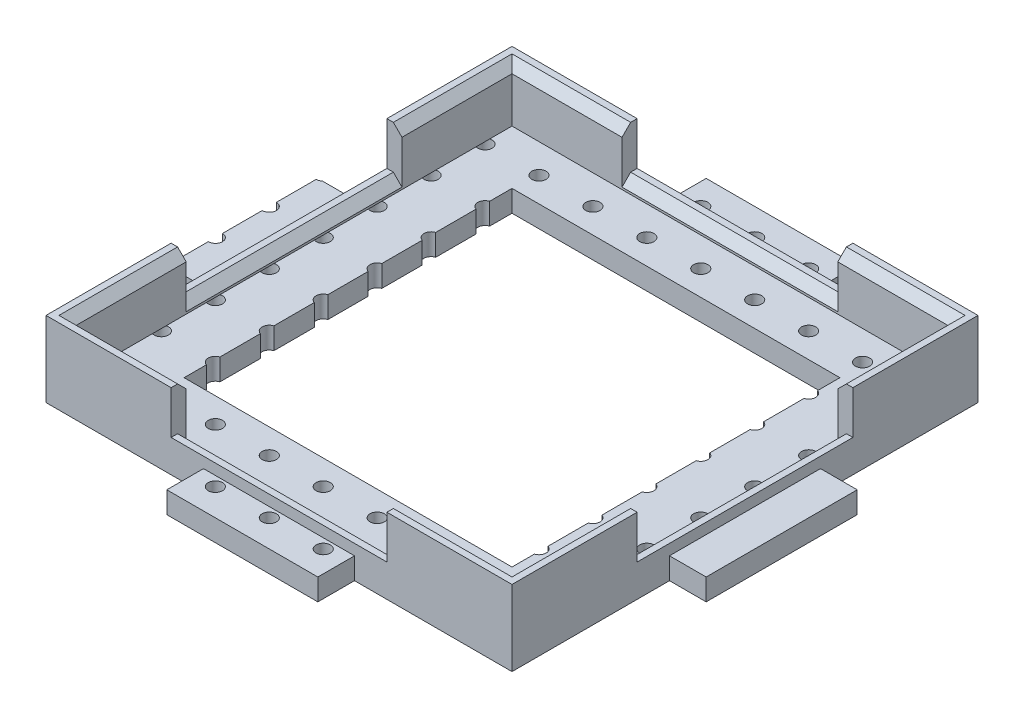
from build123d import *

# Parameters (mm, degrees)
SKETCH1_W                      = 216
SKETCH1_H                      = 216
SKETCH1_W_2                    = 202
SKETCH1_H_2                    = 202
BOSS_EXTRUDE1_DEPTH            = 25
SKETCH3_W                      = 100
SKETCH3_H                      = 20
CUT_EXTRUDE1_DEPTH             = 155.767567662
SKETCH2_W                      = 216
SKETCH2_H                      = 216
SKETCH2_W_2                    = 152
SKETCH2_H_2                    = 152
BOSS_EXTRUDE2_DEPTH            = 10
SKETCH4_W                      = 70
SKETCH4_H                      = 17
BOSS_EXTRUDE3_DEPTH            = 10
SKETCH5_R                      = 3.3
CUT_EXTRUDE2_DEPTH             = 168.074833533
CIRPATTERN1_COUNT              = 4
LPATTERN1_COUNT                = 11
LPATTERN1_PITCH                = 25
LPATTERN2_COUNT                = 5
LPATTERN2_PITCH                = 25
LPATTERN2_COPY_1_SKETCH_R      = 3.3
LPATTERN2_COPY_1_DEPTH         = 168.074833533
LPATTERN2_COPY_2_SKETCH_R      = 3.3
LPATTERN2_COPY_2_DEPTH         = 168.074833533
LPATTERN2_COPY_3_SKETCH_R      = 3.3
LPATTERN2_COPY_3_DEPTH         = 168.074833533
LPATTERN2_COPY_4_SKETCH_R      = 3.3
LPATTERN2_COPY_4_DEPTH         = 168.074833533
LPATTERN2_COPY_5_SKETCH_R      = 3.3
LPATTERN2_COPY_5_DEPTH         = 168.074833533
LPATTERN2_COPY_6_SKETCH_R      = 3.3
LPATTERN2_COPY_6_DEPTH         = 168.074833533
LPATTERN2_COPY_7_SKETCH_R      = 3.3
LPATTERN2_COPY_7_DEPTH         = 168.074833533
LPATTERN2_COPY_8_SKETCH_R      = 3.3
LPATTERN2_COPY_8_DEPTH         = 168.074833533
LPATTERN2_COPY_9_SKETCH_R      = 3.3
LPATTERN2_COPY_9_DEPTH         = 168.074833533
LPATTERN2_COPY_10_SKETCH_R     = 3.3
LPATTERN2_COPY_10_DEPTH        = 168.074833533
LPATTERN2_COPY_11_SKETCH_R     = 3.3
LPATTERN2_COPY_11_DEPTH        = 168.074833533
LPATTERN2_COPY_12_SKETCH_R     = 3.3
LPATTERN2_COPY_12_DEPTH        = 168.074833533
LPATTERN2_COPY_13_SKETCH_R     = 3.3
LPATTERN2_COPY_13_DEPTH        = 168.074833533
LPATTERN2_COPY_14_SKETCH_R     = 3.3
LPATTERN2_COPY_14_DEPTH        = 168.074833533
LPATTERN2_COPY_15_SKETCH_R     = 3.3
LPATTERN2_COPY_15_DEPTH        = 168.074833533
LPATTERN2_COPY_16_SKETCH_R     = 3.3
LPATTERN2_COPY_16_DEPTH        = 168.074833533
LPATTERN2_COPY_17_SKETCH_R     = 3.3
LPATTERN2_COPY_17_DEPTH        = 168.074833533
LPATTERN2_COPY_18_SKETCH_R     = 3.3
LPATTERN2_COPY_18_DEPTH        = 168.074833533
LPATTERN2_COPY_19_SKETCH_R     = 3.3
LPATTERN2_COPY_19_DEPTH        = 168.074833533
LPATTERN2_COPY_20_SKETCH_R     = 3.3
LPATTERN2_COPY_20_DEPTH        = 168.074833533
LPATTERN2_COPY_21_SKETCH_R     = 3.3
LPATTERN2_COPY_21_DEPTH        = 168.074833533
LPATTERN2_COPY_22_SKETCH_R     = 3.3
LPATTERN2_COPY_22_DEPTH        = 168.074833533
LPATTERN2_COPY_23_SKETCH_R     = 3.3
LPATTERN2_COPY_23_DEPTH        = 168.074833533
LPATTERN2_COPY_24_SKETCH_R     = 3.3
LPATTERN2_COPY_24_DEPTH        = 168.074833533
LPATTERN2_COPY_25_SKETCH_R     = 3.3
LPATTERN2_COPY_25_DEPTH        = 168.074833533
LPATTERN2_COPY_26_SKETCH_R     = 3.3
LPATTERN2_COPY_26_DEPTH        = 168.074833533
LPATTERN2_COPY_27_SKETCH_R     = 3.3
LPATTERN2_COPY_27_DEPTH        = 168.074833533
LPATTERN2_COPY_28_SKETCH_R     = 3.3
LPATTERN2_COPY_28_DEPTH        = 168.074833533
LPATTERN2_COPY_29_SKETCH_R     = 3.3
LPATTERN2_COPY_29_DEPTH        = 168.074833533
LPATTERN2_COPY_30_SKETCH_R     = 3.3
LPATTERN2_COPY_30_DEPTH        = 168.074833533
LPATTERN2_COPY_31_SKETCH_R     = 3.3
LPATTERN2_COPY_31_DEPTH        = 168.074833533
LPATTERN2_COPY_32_SKETCH_R     = 3.3
LPATTERN2_COPY_32_DEPTH        = 168.074833533
LPATTERN2_COPY_33_SKETCH_R     = 3.3
LPATTERN2_COPY_33_DEPTH        = 168.074833533
LPATTERN2_COPY_34_SKETCH_R     = 3.3
LPATTERN2_COPY_34_DEPTH        = 168.074833533
LPATTERN2_COPY_35_SKETCH_R     = 3.3
LPATTERN2_COPY_35_DEPTH        = 168.074833533
LPATTERN2_COPY_36_SKETCH_R     = 3.3
LPATTERN2_COPY_36_DEPTH        = 168.074833533
LPATTERN2_COPY_37_SKETCH_R     = 3.3
LPATTERN2_COPY_37_DEPTH        = 168.074833533
LPATTERN2_COPY_38_SKETCH_R     = 3.3
LPATTERN2_COPY_38_DEPTH        = 168.074833533
LPATTERN2_COPY_39_SKETCH_R     = 3.3
LPATTERN2_COPY_39_DEPTH        = 168.074833533
LPATTERN2_COPY_40_SKETCH_R     = 3.3
LPATTERN2_COPY_40_DEPTH        = 168.074833533
LPATTERN2_COL_COUNT            = 6
LPATTERN2_COL_PITCH            = 25
LPATTERN2_COL_COPY_1_SKETCH_R  = 3.3
LPATTERN2_COL_COPY_1_DEPTH     = 168.074833533
LPATTERN2_COL_COPY_2_SKETCH_R  = 3.3
LPATTERN2_COL_COPY_2_DEPTH     = 168.074833533
LPATTERN2_COL_COPY_3_SKETCH_R  = 3.3
LPATTERN2_COL_COPY_3_DEPTH     = 168.074833533
LPATTERN2_COL_COPY_4_SKETCH_R  = 3.3
LPATTERN2_COL_COPY_4_DEPTH     = 168.074833533
LPATTERN2_COL_COPY_5_SKETCH_R  = 3.3
LPATTERN2_COL_COPY_5_DEPTH     = 168.074833533
LPATTERN2_COL_COPY_6_SKETCH_R  = 3.3
LPATTERN2_COL_COPY_6_DEPTH     = 168.074833533
LPATTERN2_COL_COPY_7_SKETCH_R  = 3.3
LPATTERN2_COL_COPY_7_DEPTH     = 168.074833533
LPATTERN2_COL_COPY_8_SKETCH_R  = 3.3
LPATTERN2_COL_COPY_8_DEPTH     = 168.074833533
LPATTERN2_COL_COPY_9_SKETCH_R  = 3.3
LPATTERN2_COL_COPY_9_DEPTH     = 168.074833533
LPATTERN2_COL_COPY_10_SKETCH_R = 3.3
LPATTERN2_COL_COPY_10_DEPTH    = 168.074833533
LPATTERN2_COL_COPY_11_SKETCH_R = 3.3
LPATTERN2_COL_COPY_11_DEPTH    = 168.074833533
LPATTERN2_COL_COPY_12_SKETCH_R = 3.3
LPATTERN2_COL_COPY_12_DEPTH    = 168.074833533
LPATTERN2_COL_COPY_13_SKETCH_R = 3.3
LPATTERN2_COL_COPY_13_DEPTH    = 168.074833533
LPATTERN2_COL_COPY_14_SKETCH_R = 3.3
LPATTERN2_COL_COPY_14_DEPTH    = 168.074833533
LPATTERN2_COL_COPY_15_SKETCH_R = 3.3
LPATTERN2_COL_COPY_15_DEPTH    = 168.074833533
LPATTERN2_COL_COPY_16_SKETCH_R = 3.3
LPATTERN2_COL_COPY_16_DEPTH    = 168.074833533
LPATTERN2_COL_COPY_17_SKETCH_R = 3.3
LPATTERN2_COL_COPY_17_DEPTH    = 168.074833533
LPATTERN2_COL_COPY_18_SKETCH_R = 3.3
LPATTERN2_COL_COPY_18_DEPTH    = 168.074833533
LPATTERN2_COL_COPY_19_SKETCH_R = 3.3
LPATTERN2_COL_COPY_19_DEPTH    = 168.074833533
LPATTERN2_COL_COPY_20_SKETCH_R = 3.3
LPATTERN2_COL_COPY_20_DEPTH    = 168.074833533
LPATTERN2_COL_COPY_21_SKETCH_R = 3.3
LPATTERN2_COL_COPY_21_DEPTH    = 168.074833533
LPATTERN2_COL_COPY_22_SKETCH_R = 3.3
LPATTERN2_COL_COPY_22_DEPTH    = 168.074833533
LPATTERN2_COL_COPY_23_SKETCH_R = 3.3
LPATTERN2_COL_COPY_23_DEPTH    = 168.074833533
LPATTERN2_COL_COPY_24_SKETCH_R = 3.3
LPATTERN2_COL_COPY_24_DEPTH    = 168.074833533
LPATTERN2_COL_COPY_25_SKETCH_R = 3.3
LPATTERN2_COL_COPY_25_DEPTH    = 168.074833533
LPATTERN2_COL_COPY_26_SKETCH_R = 3.3
LPATTERN2_COL_COPY_26_DEPTH    = 168.074833533
LPATTERN2_COL_COPY_27_SKETCH_R = 3.3
LPATTERN2_COL_COPY_27_DEPTH    = 168.074833533
LPATTERN2_COL_COPY_28_SKETCH_R = 3.3
LPATTERN2_COL_COPY_28_DEPTH    = 168.074833533
LPATTERN2_COL_COPY_29_SKETCH_R = 3.3
LPATTERN2_COL_COPY_29_DEPTH    = 168.074833533
LPATTERN2_COL_COPY_30_SKETCH_R = 3.3
LPATTERN2_COL_COPY_30_DEPTH    = 168.074833533
LPATTERN2_COL_COPY_31_SKETCH_R = 3.3
LPATTERN2_COL_COPY_31_DEPTH    = 168.074833533
LPATTERN2_COL_COPY_32_SKETCH_R = 3.3
LPATTERN2_COL_COPY_32_DEPTH    = 168.074833533
LPATTERN2_COL_COPY_33_SKETCH_R = 3.3
LPATTERN2_COL_COPY_33_DEPTH    = 168.074833533
LPATTERN2_COL_COPY_34_SKETCH_R = 3.3
LPATTERN2_COL_COPY_34_DEPTH    = 168.074833533
LPATTERN2_COL_COPY_35_SKETCH_R = 3.3
LPATTERN2_COL_COPY_35_DEPTH    = 168.074833533
LPATTERN2_COL_COPY_36_SKETCH_R = 3.3
LPATTERN2_COL_COPY_36_DEPTH    = 168.074833533
LPATTERN2_COL_COPY_37_SKETCH_R = 3.3
LPATTERN2_COL_COPY_37_DEPTH    = 168.074833533
LPATTERN2_COL_COPY_38_SKETCH_R = 3.3
LPATTERN2_COL_COPY_38_DEPTH    = 168.074833533
LPATTERN2_COL_COPY_39_SKETCH_R = 3.3
LPATTERN2_COL_COPY_39_DEPTH    = 168.074833533
LPATTERN2_COL_COPY_40_SKETCH_R = 3.3
LPATTERN2_COL_COPY_40_DEPTH    = 168.074833533
LPATTERN2_COL_COPY_41_SKETCH_R = 3.3
LPATTERN2_COL_COPY_41_DEPTH    = 168.074833533
LPATTERN2_COL_COPY_42_SKETCH_R = 3.3
LPATTERN2_COL_COPY_42_DEPTH    = 168.074833533
LPATTERN2_COL_COPY_43_SKETCH_R = 3.3
LPATTERN2_COL_COPY_43_DEPTH    = 168.074833533
LPATTERN2_COL_COPY_44_SKETCH_R = 3.3
LPATTERN2_COL_COPY_44_DEPTH    = 168.074833533
LPATTERN2_COL_COPY_45_SKETCH_R = 3.3
LPATTERN2_COL_COPY_45_DEPTH    = 168.074833533
LPATTERN2_COL_COPY_46_SKETCH_R = 3.3
LPATTERN2_COL_COPY_46_DEPTH    = 168.074833533
LPATTERN2_COL_COPY_47_SKETCH_R = 3.3
LPATTERN2_COL_COPY_47_DEPTH    = 168.074833533
LPATTERN2_COL_COPY_48_SKETCH_R = 3.3
LPATTERN2_COL_COPY_48_DEPTH    = 168.074833533
LPATTERN2_COL_COPY_49_SKETCH_R = 3.3
LPATTERN2_COL_COPY_49_DEPTH    = 168.074833533
LPATTERN2_COL_COPY_50_SKETCH_R = 3.3
LPATTERN2_COL_COPY_50_DEPTH    = 168.074833533
CHAMFER1_SIZE                  = 4


with BuildPart() as part:
    # Sketch1 → Boss-Extrude1 (new body)
    with BuildSketch(Plane(origin=(0, 0, 0), x_dir=(1, 0, 0), z_dir=(0, 1, 0))):
        Rectangle(SKETCH1_W, SKETCH1_H)
        Rectangle(SKETCH1_W_2, SKETCH1_H_2, mode=Mode.SUBTRACT)
    extrude(amount=BOSS_EXTRUDE1_DEPTH)

    # Sketch3 → Cut-Extrude1 (cut, through all)
    with BuildSketch(Plane.XY):
        with Locations((0, 15)):
            Rectangle(SKETCH3_W, SKETCH3_H)
    cut_extrude1 = extrude(amount=CUT_EXTRUDE1_DEPTH, mode=Mode.SUBTRACT)

    # Sketch2 → Boss-Extrude2 (add)
    with BuildSketch(Plane(origin=(0, 0, 0), x_dir=(1, 0, 0), z_dir=(0, 1, 0))):
        Rectangle(SKETCH2_W, SKETCH2_H)
        Rectangle(SKETCH2_W_2, SKETCH2_H_2, mode=Mode.SUBTRACT)
    extrude(amount=-BOSS_EXTRUDE2_DEPTH)

    # Sketch4 → Boss-Extrude3 (add)
    with BuildSketch(Plane(origin=(0, 0, 0), x_dir=(1, 0, 0), z_dir=(0, 1, 0))):
        with Locations((0, -116.5)):
            Rectangle(SKETCH4_W, SKETCH4_H)
    boss_extrude3 = extrude(amount=-BOSS_EXTRUDE3_DEPTH)

    # Sketch5 → Cut-Extrude2 (cut, through all)
    with BuildSketch(Plane(origin=(0, 0, 0), x_dir=(1, 0, 0), z_dir=(0, 1, 0))):
        with Locations(Location((-25, -112.5, 0), (0, 0, 270))):
            Circle(SKETCH5_R)
    cut_extrude2 = extrude(amount=-CUT_EXTRUDE2_DEPTH, mode=Mode.SUBTRACT)

    # CirPattern1: Cut-Extrude1, Boss-Extrude3 ×4 about axis
    cirpattern1_axis = Axis((0, 0, 0), (0, 1, 0))
    add([cut_extrude1.rotate(cirpattern1_axis, i * 360 / CIRPATTERN1_COUNT) for i in range(1, CIRPATTERN1_COUNT)], mode=Mode.SUBTRACT)
    add([boss_extrude3.rotate(cirpattern1_axis, i * 360 / CIRPATTERN1_COUNT) for i in range(1, CIRPATTERN1_COUNT)])

    # LPattern1: Cut-Extrude2 ×11
    with Locations(*[(0, 0, -i * LPATTERN1_PITCH) for i in range(1, LPATTERN1_COUNT)]):
        add(cut_extrude2, mode=Mode.SUBTRACT)

    # LPattern2: Cut-Extrude2 ×5
    with Locations(*[(-i * LPATTERN2_PITCH, 0, 0) for i in range(1, LPATTERN2_COUNT)]):
        add(cut_extrude2, mode=Mode.SUBTRACT)

    # LPattern2 copy 1 sketch → LPattern2 copy 1 (cut, through all)
    with BuildSketch(Plane(origin=(-25, 0, -25), x_dir=(1, 0, 0), z_dir=(0, 1, 0))):
        with Locations(Location((-25, -112.5, 0), (0, 0, 270))):
            Circle(LPATTERN2_COPY_1_SKETCH_R)
    extrude(amount=-LPATTERN2_COPY_1_DEPTH, mode=Mode.SUBTRACT)

    # LPattern2 copy 2 sketch → LPattern2 copy 2 (cut, through all)
    with BuildSketch(Plane(origin=(-50, 0, -25), x_dir=(1, 0, 0), z_dir=(0, 1, 0))):
        with Locations(Location((-25, -112.5, 0), (0, 0, 270))):
            Circle(LPATTERN2_COPY_2_SKETCH_R)
    extrude(amount=-LPATTERN2_COPY_2_DEPTH, mode=Mode.SUBTRACT)

    # LPattern2 copy 3 sketch → LPattern2 copy 3 (cut, through all)
    with BuildSketch(Plane(origin=(-75, 0, -25), x_dir=(1, 0, 0), z_dir=(0, 1, 0))):
        with Locations(Location((-25, -112.5, 0), (0, 0, 270))):
            Circle(LPATTERN2_COPY_3_SKETCH_R)
    extrude(amount=-LPATTERN2_COPY_3_DEPTH, mode=Mode.SUBTRACT)

    # LPattern2 copy 4 sketch → LPattern2 copy 4 (cut, through all)
    with BuildSketch(Plane(origin=(-100, 0, -25), x_dir=(1, 0, 0), z_dir=(0, 1, 0))):
        with Locations(Location((-25, -112.5, 0), (0, 0, 270))):
            Circle(LPATTERN2_COPY_4_SKETCH_R)
    extrude(amount=-LPATTERN2_COPY_4_DEPTH, mode=Mode.SUBTRACT)

    # LPattern2 copy 5 sketch → LPattern2 copy 5 (cut, through all)
    with BuildSketch(Plane(origin=(-25, 0, -50), x_dir=(1, 0, 0), z_dir=(0, 1, 0))):
        with Locations(Location((-25, -112.5, 0), (0, 0, 270))):
            Circle(LPATTERN2_COPY_5_SKETCH_R)
    extrude(amount=-LPATTERN2_COPY_5_DEPTH, mode=Mode.SUBTRACT)

    # LPattern2 copy 6 sketch → LPattern2 copy 6 (cut, through all)
    with BuildSketch(Plane(origin=(-50, 0, -50), x_dir=(1, 0, 0), z_dir=(0, 1, 0))):
        with Locations(Location((-25, -112.5, 0), (0, 0, 270))):
            Circle(LPATTERN2_COPY_6_SKETCH_R)
    extrude(amount=-LPATTERN2_COPY_6_DEPTH, mode=Mode.SUBTRACT)

    # LPattern2 copy 7 sketch → LPattern2 copy 7 (cut, through all)
    with BuildSketch(Plane(origin=(-75, 0, -50), x_dir=(1, 0, 0), z_dir=(0, 1, 0))):
        with Locations(Location((-25, -112.5, 0), (0, 0, 270))):
            Circle(LPATTERN2_COPY_7_SKETCH_R)
    extrude(amount=-LPATTERN2_COPY_7_DEPTH, mode=Mode.SUBTRACT)

    # LPattern2 copy 8 sketch → LPattern2 copy 8 (cut, through all)
    with BuildSketch(Plane(origin=(-100, 0, -50), x_dir=(1, 0, 0), z_dir=(0, 1, 0))):
        with Locations(Location((-25, -112.5, 0), (0, 0, 270))):
            Circle(LPATTERN2_COPY_8_SKETCH_R)
    extrude(amount=-LPATTERN2_COPY_8_DEPTH, mode=Mode.SUBTRACT)

    # LPattern2 copy 9 sketch → LPattern2 copy 9 (cut, through all)
    with BuildSketch(Plane(origin=(-25, 0, -75), x_dir=(1, 0, 0), z_dir=(0, 1, 0))):
        with Locations(Location((-25, -112.5, 0), (0, 0, 270))):
            Circle(LPATTERN2_COPY_9_SKETCH_R)
    extrude(amount=-LPATTERN2_COPY_9_DEPTH, mode=Mode.SUBTRACT)

    # LPattern2 copy 10 sketch → LPattern2 copy 10 (cut, through all)
    with BuildSketch(Plane(origin=(-50, 0, -75), x_dir=(1, 0, 0), z_dir=(0, 1, 0))):
        with Locations(Location((-25, -112.5, 0), (0, 0, 270))):
            Circle(LPATTERN2_COPY_10_SKETCH_R)
    extrude(amount=-LPATTERN2_COPY_10_DEPTH, mode=Mode.SUBTRACT)

    # LPattern2 copy 11 sketch → LPattern2 copy 11 (cut, through all)
    with BuildSketch(Plane(origin=(-75, 0, -75), x_dir=(1, 0, 0), z_dir=(0, 1, 0))):
        with Locations(Location((-25, -112.5, 0), (0, 0, 270))):
            Circle(LPATTERN2_COPY_11_SKETCH_R)
    extrude(amount=-LPATTERN2_COPY_11_DEPTH, mode=Mode.SUBTRACT)

    # LPattern2 copy 12 sketch → LPattern2 copy 12 (cut, through all)
    with BuildSketch(Plane(origin=(-100, 0, -75), x_dir=(1, 0, 0), z_dir=(0, 1, 0))):
        with Locations(Location((-25, -112.5, 0), (0, 0, 270))):
            Circle(LPATTERN2_COPY_12_SKETCH_R)
    extrude(amount=-LPATTERN2_COPY_12_DEPTH, mode=Mode.SUBTRACT)

    # LPattern2 copy 13 sketch → LPattern2 copy 13 (cut, through all)
    with BuildSketch(Plane(origin=(-25, 0, -100), x_dir=(1, 0, 0), z_dir=(0, 1, 0))):
        with Locations(Location((-25, -112.5, 0), (0, 0, 270))):
            Circle(LPATTERN2_COPY_13_SKETCH_R)
    extrude(amount=-LPATTERN2_COPY_13_DEPTH, mode=Mode.SUBTRACT)

    # LPattern2 copy 14 sketch → LPattern2 copy 14 (cut, through all)
    with BuildSketch(Plane(origin=(-50, 0, -100), x_dir=(1, 0, 0), z_dir=(0, 1, 0))):
        with Locations(Location((-25, -112.5, 0), (0, 0, 270))):
            Circle(LPATTERN2_COPY_14_SKETCH_R)
    extrude(amount=-LPATTERN2_COPY_14_DEPTH, mode=Mode.SUBTRACT)

    # LPattern2 copy 15 sketch → LPattern2 copy 15 (cut, through all)
    with BuildSketch(Plane(origin=(-75, 0, -100), x_dir=(1, 0, 0), z_dir=(0, 1, 0))):
        with Locations(Location((-25, -112.5, 0), (0, 0, 270))):
            Circle(LPATTERN2_COPY_15_SKETCH_R)
    extrude(amount=-LPATTERN2_COPY_15_DEPTH, mode=Mode.SUBTRACT)

    # LPattern2 copy 16 sketch → LPattern2 copy 16 (cut, through all)
    with BuildSketch(Plane(origin=(-100, 0, -100), x_dir=(1, 0, 0), z_dir=(0, 1, 0))):
        with Locations(Location((-25, -112.5, 0), (0, 0, 270))):
            Circle(LPATTERN2_COPY_16_SKETCH_R)
    extrude(amount=-LPATTERN2_COPY_16_DEPTH, mode=Mode.SUBTRACT)

    # LPattern2 copy 17 sketch → LPattern2 copy 17 (cut, through all)
    with BuildSketch(Plane(origin=(-25, 0, -125), x_dir=(1, 0, 0), z_dir=(0, 1, 0))):
        with Locations(Location((-25, -112.5, 0), (0, 0, 270))):
            Circle(LPATTERN2_COPY_17_SKETCH_R)
    extrude(amount=-LPATTERN2_COPY_17_DEPTH, mode=Mode.SUBTRACT)

    # LPattern2 copy 18 sketch → LPattern2 copy 18 (cut, through all)
    with BuildSketch(Plane(origin=(-50, 0, -125), x_dir=(1, 0, 0), z_dir=(0, 1, 0))):
        with Locations(Location((-25, -112.5, 0), (0, 0, 270))):
            Circle(LPATTERN2_COPY_18_SKETCH_R)
    extrude(amount=-LPATTERN2_COPY_18_DEPTH, mode=Mode.SUBTRACT)

    # LPattern2 copy 19 sketch → LPattern2 copy 19 (cut, through all)
    with BuildSketch(Plane(origin=(-75, 0, -125), x_dir=(1, 0, 0), z_dir=(0, 1, 0))):
        with Locations(Location((-25, -112.5, 0), (0, 0, 270))):
            Circle(LPATTERN2_COPY_19_SKETCH_R)
    extrude(amount=-LPATTERN2_COPY_19_DEPTH, mode=Mode.SUBTRACT)

    # LPattern2 copy 20 sketch → LPattern2 copy 20 (cut, through all)
    with BuildSketch(Plane(origin=(-100, 0, -125), x_dir=(1, 0, 0), z_dir=(0, 1, 0))):
        with Locations(Location((-25, -112.5, 0), (0, 0, 270))):
            Circle(LPATTERN2_COPY_20_SKETCH_R)
    extrude(amount=-LPATTERN2_COPY_20_DEPTH, mode=Mode.SUBTRACT)

    # LPattern2 copy 21 sketch → LPattern2 copy 21 (cut, through all)
    with BuildSketch(Plane(origin=(-25, 0, -150), x_dir=(1, 0, 0), z_dir=(0, 1, 0))):
        with Locations(Location((-25, -112.5, 0), (0, 0, 270))):
            Circle(LPATTERN2_COPY_21_SKETCH_R)
    extrude(amount=-LPATTERN2_COPY_21_DEPTH, mode=Mode.SUBTRACT)

    # LPattern2 copy 22 sketch → LPattern2 copy 22 (cut, through all)
    with BuildSketch(Plane(origin=(-50, 0, -150), x_dir=(1, 0, 0), z_dir=(0, 1, 0))):
        with Locations(Location((-25, -112.5, 0), (0, 0, 270))):
            Circle(LPATTERN2_COPY_22_SKETCH_R)
    extrude(amount=-LPATTERN2_COPY_22_DEPTH, mode=Mode.SUBTRACT)

    # LPattern2 copy 23 sketch → LPattern2 copy 23 (cut, through all)
    with BuildSketch(Plane(origin=(-75, 0, -150), x_dir=(1, 0, 0), z_dir=(0, 1, 0))):
        with Locations(Location((-25, -112.5, 0), (0, 0, 270))):
            Circle(LPATTERN2_COPY_23_SKETCH_R)
    extrude(amount=-LPATTERN2_COPY_23_DEPTH, mode=Mode.SUBTRACT)

    # LPattern2 copy 24 sketch → LPattern2 copy 24 (cut, through all)
    with BuildSketch(Plane(origin=(-100, 0, -150), x_dir=(1, 0, 0), z_dir=(0, 1, 0))):
        with Locations(Location((-25, -112.5, 0), (0, 0, 270))):
            Circle(LPATTERN2_COPY_24_SKETCH_R)
    extrude(amount=-LPATTERN2_COPY_24_DEPTH, mode=Mode.SUBTRACT)

    # LPattern2 copy 25 sketch → LPattern2 copy 25 (cut, through all)
    with BuildSketch(Plane(origin=(-25, 0, -175), x_dir=(1, 0, 0), z_dir=(0, 1, 0))):
        with Locations(Location((-25, -112.5, 0), (0, 0, 270))):
            Circle(LPATTERN2_COPY_25_SKETCH_R)
    extrude(amount=-LPATTERN2_COPY_25_DEPTH, mode=Mode.SUBTRACT)

    # LPattern2 copy 26 sketch → LPattern2 copy 26 (cut, through all)
    with BuildSketch(Plane(origin=(-50, 0, -175), x_dir=(1, 0, 0), z_dir=(0, 1, 0))):
        with Locations(Location((-25, -112.5, 0), (0, 0, 270))):
            Circle(LPATTERN2_COPY_26_SKETCH_R)
    extrude(amount=-LPATTERN2_COPY_26_DEPTH, mode=Mode.SUBTRACT)

    # LPattern2 copy 27 sketch → LPattern2 copy 27 (cut, through all)
    with BuildSketch(Plane(origin=(-75, 0, -175), x_dir=(1, 0, 0), z_dir=(0, 1, 0))):
        with Locations(Location((-25, -112.5, 0), (0, 0, 270))):
            Circle(LPATTERN2_COPY_27_SKETCH_R)
    extrude(amount=-LPATTERN2_COPY_27_DEPTH, mode=Mode.SUBTRACT)

    # LPattern2 copy 28 sketch → LPattern2 copy 28 (cut, through all)
    with BuildSketch(Plane(origin=(-100, 0, -175), x_dir=(1, 0, 0), z_dir=(0, 1, 0))):
        with Locations(Location((-25, -112.5, 0), (0, 0, 270))):
            Circle(LPATTERN2_COPY_28_SKETCH_R)
    extrude(amount=-LPATTERN2_COPY_28_DEPTH, mode=Mode.SUBTRACT)

    # LPattern2 copy 29 sketch → LPattern2 copy 29 (cut, through all)
    with BuildSketch(Plane(origin=(-25, 0, -200), x_dir=(1, 0, 0), z_dir=(0, 1, 0))):
        with Locations(Location((-25, -112.5, 0), (0, 0, 270))):
            Circle(LPATTERN2_COPY_29_SKETCH_R)
    extrude(amount=-LPATTERN2_COPY_29_DEPTH, mode=Mode.SUBTRACT)

    # LPattern2 copy 30 sketch → LPattern2 copy 30 (cut, through all)
    with BuildSketch(Plane(origin=(-50, 0, -200), x_dir=(1, 0, 0), z_dir=(0, 1, 0))):
        with Locations(Location((-25, -112.5, 0), (0, 0, 270))):
            Circle(LPATTERN2_COPY_30_SKETCH_R)
    extrude(amount=-LPATTERN2_COPY_30_DEPTH, mode=Mode.SUBTRACT)

    # LPattern2 copy 31 sketch → LPattern2 copy 31 (cut, through all)
    with BuildSketch(Plane(origin=(-75, 0, -200), x_dir=(1, 0, 0), z_dir=(0, 1, 0))):
        with Locations(Location((-25, -112.5, 0), (0, 0, 270))):
            Circle(LPATTERN2_COPY_31_SKETCH_R)
    extrude(amount=-LPATTERN2_COPY_31_DEPTH, mode=Mode.SUBTRACT)

    # LPattern2 copy 32 sketch → LPattern2 copy 32 (cut, through all)
    with BuildSketch(Plane(origin=(-100, 0, -200), x_dir=(1, 0, 0), z_dir=(0, 1, 0))):
        with Locations(Location((-25, -112.5, 0), (0, 0, 270))):
            Circle(LPATTERN2_COPY_32_SKETCH_R)
    extrude(amount=-LPATTERN2_COPY_32_DEPTH, mode=Mode.SUBTRACT)

    # LPattern2 copy 33 sketch → LPattern2 copy 33 (cut, through all)
    with BuildSketch(Plane(origin=(-25, 0, -225), x_dir=(1, 0, 0), z_dir=(0, 1, 0))):
        with Locations(Location((-25, -112.5, 0), (0, 0, 270))):
            Circle(LPATTERN2_COPY_33_SKETCH_R)
    extrude(amount=-LPATTERN2_COPY_33_DEPTH, mode=Mode.SUBTRACT)

    # LPattern2 copy 34 sketch → LPattern2 copy 34 (cut, through all)
    with BuildSketch(Plane(origin=(-50, 0, -225), x_dir=(1, 0, 0), z_dir=(0, 1, 0))):
        with Locations(Location((-25, -112.5, 0), (0, 0, 270))):
            Circle(LPATTERN2_COPY_34_SKETCH_R)
    extrude(amount=-LPATTERN2_COPY_34_DEPTH, mode=Mode.SUBTRACT)

    # LPattern2 copy 35 sketch → LPattern2 copy 35 (cut, through all)
    with BuildSketch(Plane(origin=(-75, 0, -225), x_dir=(1, 0, 0), z_dir=(0, 1, 0))):
        with Locations(Location((-25, -112.5, 0), (0, 0, 270))):
            Circle(LPATTERN2_COPY_35_SKETCH_R)
    extrude(amount=-LPATTERN2_COPY_35_DEPTH, mode=Mode.SUBTRACT)

    # LPattern2 copy 36 sketch → LPattern2 copy 36 (cut, through all)
    with BuildSketch(Plane(origin=(-100, 0, -225), x_dir=(1, 0, 0), z_dir=(0, 1, 0))):
        with Locations(Location((-25, -112.5, 0), (0, 0, 270))):
            Circle(LPATTERN2_COPY_36_SKETCH_R)
    extrude(amount=-LPATTERN2_COPY_36_DEPTH, mode=Mode.SUBTRACT)

    # LPattern2 copy 37 sketch → LPattern2 copy 37 (cut, through all)
    with BuildSketch(Plane(origin=(-25, 0, -250), x_dir=(1, 0, 0), z_dir=(0, 1, 0))):
        with Locations(Location((-25, -112.5, 0), (0, 0, 270))):
            Circle(LPATTERN2_COPY_37_SKETCH_R)
    extrude(amount=-LPATTERN2_COPY_37_DEPTH, mode=Mode.SUBTRACT)

    # LPattern2 copy 38 sketch → LPattern2 copy 38 (cut, through all)
    with BuildSketch(Plane(origin=(-50, 0, -250), x_dir=(1, 0, 0), z_dir=(0, 1, 0))):
        with Locations(Location((-25, -112.5, 0), (0, 0, 270))):
            Circle(LPATTERN2_COPY_38_SKETCH_R)
    extrude(amount=-LPATTERN2_COPY_38_DEPTH, mode=Mode.SUBTRACT)

    # LPattern2 copy 39 sketch → LPattern2 copy 39 (cut, through all)
    with BuildSketch(Plane(origin=(-75, 0, -250), x_dir=(1, 0, 0), z_dir=(0, 1, 0))):
        with Locations(Location((-25, -112.5, 0), (0, 0, 270))):
            Circle(LPATTERN2_COPY_39_SKETCH_R)
    extrude(amount=-LPATTERN2_COPY_39_DEPTH, mode=Mode.SUBTRACT)

    # LPattern2 copy 40 sketch → LPattern2 copy 40 (cut, through all)
    with BuildSketch(Plane(origin=(-100, 0, -250), x_dir=(1, 0, 0), z_dir=(0, 1, 0))):
        with Locations(Location((-25, -112.5, 0), (0, 0, 270))):
            Circle(LPATTERN2_COPY_40_SKETCH_R)
    extrude(amount=-LPATTERN2_COPY_40_DEPTH, mode=Mode.SUBTRACT)

    # LPattern2 col: Cut-Extrude2 ×6
    with Locations(*[(i * LPATTERN2_COL_PITCH, 0, 0) for i in range(1, LPATTERN2_COL_COUNT)]):
        add(cut_extrude2, mode=Mode.SUBTRACT)

    # LPattern2 col copy 1 sketch → LPattern2 col copy 1 (cut, through all)
    with BuildSketch(Plane(origin=(25, 0, -25), x_dir=(1, 0, 0), z_dir=(0, 1, 0))):
        with Locations(Location((-25, -112.5, 0), (0, 0, 270))):
            Circle(LPATTERN2_COL_COPY_1_SKETCH_R)
    extrude(amount=-LPATTERN2_COL_COPY_1_DEPTH, mode=Mode.SUBTRACT)

    # LPattern2 col copy 2 sketch → LPattern2 col copy 2 (cut, through all)
    with BuildSketch(Plane(origin=(50, 0, -25), x_dir=(1, 0, 0), z_dir=(0, 1, 0))):
        with Locations(Location((-25, -112.5, 0), (0, 0, 270))):
            Circle(LPATTERN2_COL_COPY_2_SKETCH_R)
    extrude(amount=-LPATTERN2_COL_COPY_2_DEPTH, mode=Mode.SUBTRACT)

    # LPattern2 col copy 3 sketch → LPattern2 col copy 3 (cut, through all)
    with BuildSketch(Plane(origin=(75, 0, -25), x_dir=(1, 0, 0), z_dir=(0, 1, 0))):
        with Locations(Location((-25, -112.5, 0), (0, 0, 270))):
            Circle(LPATTERN2_COL_COPY_3_SKETCH_R)
    extrude(amount=-LPATTERN2_COL_COPY_3_DEPTH, mode=Mode.SUBTRACT)

    # LPattern2 col copy 4 sketch → LPattern2 col copy 4 (cut, through all)
    with BuildSketch(Plane(origin=(100, 0, -25), x_dir=(1, 0, 0), z_dir=(0, 1, 0))):
        with Locations(Location((-25, -112.5, 0), (0, 0, 270))):
            Circle(LPATTERN2_COL_COPY_4_SKETCH_R)
    extrude(amount=-LPATTERN2_COL_COPY_4_DEPTH, mode=Mode.SUBTRACT)

    # LPattern2 col copy 5 sketch → LPattern2 col copy 5 (cut, through all)
    with BuildSketch(Plane(origin=(125, 0, -25), x_dir=(1, 0, 0), z_dir=(0, 1, 0))):
        with Locations(Location((-25, -112.5, 0), (0, 0, 270))):
            Circle(LPATTERN2_COL_COPY_5_SKETCH_R)
    extrude(amount=-LPATTERN2_COL_COPY_5_DEPTH, mode=Mode.SUBTRACT)

    # LPattern2 col copy 6 sketch → LPattern2 col copy 6 (cut, through all)
    with BuildSketch(Plane(origin=(25, 0, -50), x_dir=(1, 0, 0), z_dir=(0, 1, 0))):
        with Locations(Location((-25, -112.5, 0), (0, 0, 270))):
            Circle(LPATTERN2_COL_COPY_6_SKETCH_R)
    extrude(amount=-LPATTERN2_COL_COPY_6_DEPTH, mode=Mode.SUBTRACT)

    # LPattern2 col copy 7 sketch → LPattern2 col copy 7 (cut, through all)
    with BuildSketch(Plane(origin=(50, 0, -50), x_dir=(1, 0, 0), z_dir=(0, 1, 0))):
        with Locations(Location((-25, -112.5, 0), (0, 0, 270))):
            Circle(LPATTERN2_COL_COPY_7_SKETCH_R)
    extrude(amount=-LPATTERN2_COL_COPY_7_DEPTH, mode=Mode.SUBTRACT)

    # LPattern2 col copy 8 sketch → LPattern2 col copy 8 (cut, through all)
    with BuildSketch(Plane(origin=(75, 0, -50), x_dir=(1, 0, 0), z_dir=(0, 1, 0))):
        with Locations(Location((-25, -112.5, 0), (0, 0, 270))):
            Circle(LPATTERN2_COL_COPY_8_SKETCH_R)
    extrude(amount=-LPATTERN2_COL_COPY_8_DEPTH, mode=Mode.SUBTRACT)

    # LPattern2 col copy 9 sketch → LPattern2 col copy 9 (cut, through all)
    with BuildSketch(Plane(origin=(100, 0, -50), x_dir=(1, 0, 0), z_dir=(0, 1, 0))):
        with Locations(Location((-25, -112.5, 0), (0, 0, 270))):
            Circle(LPATTERN2_COL_COPY_9_SKETCH_R)
    extrude(amount=-LPATTERN2_COL_COPY_9_DEPTH, mode=Mode.SUBTRACT)

    # LPattern2 col copy 10 sketch → LPattern2 col copy 10 (cut, through all)
    with BuildSketch(Plane(origin=(125, 0, -50), x_dir=(1, 0, 0), z_dir=(0, 1, 0))):
        with Locations(Location((-25, -112.5, 0), (0, 0, 270))):
            Circle(LPATTERN2_COL_COPY_10_SKETCH_R)
    extrude(amount=-LPATTERN2_COL_COPY_10_DEPTH, mode=Mode.SUBTRACT)

    # LPattern2 col copy 11 sketch → LPattern2 col copy 11 (cut, through all)
    with BuildSketch(Plane(origin=(25, 0, -75), x_dir=(1, 0, 0), z_dir=(0, 1, 0))):
        with Locations(Location((-25, -112.5, 0), (0, 0, 270))):
            Circle(LPATTERN2_COL_COPY_11_SKETCH_R)
    extrude(amount=-LPATTERN2_COL_COPY_11_DEPTH, mode=Mode.SUBTRACT)

    # LPattern2 col copy 12 sketch → LPattern2 col copy 12 (cut, through all)
    with BuildSketch(Plane(origin=(50, 0, -75), x_dir=(1, 0, 0), z_dir=(0, 1, 0))):
        with Locations(Location((-25, -112.5, 0), (0, 0, 270))):
            Circle(LPATTERN2_COL_COPY_12_SKETCH_R)
    extrude(amount=-LPATTERN2_COL_COPY_12_DEPTH, mode=Mode.SUBTRACT)

    # LPattern2 col copy 13 sketch → LPattern2 col copy 13 (cut, through all)
    with BuildSketch(Plane(origin=(75, 0, -75), x_dir=(1, 0, 0), z_dir=(0, 1, 0))):
        with Locations(Location((-25, -112.5, 0), (0, 0, 270))):
            Circle(LPATTERN2_COL_COPY_13_SKETCH_R)
    extrude(amount=-LPATTERN2_COL_COPY_13_DEPTH, mode=Mode.SUBTRACT)

    # LPattern2 col copy 14 sketch → LPattern2 col copy 14 (cut, through all)
    with BuildSketch(Plane(origin=(100, 0, -75), x_dir=(1, 0, 0), z_dir=(0, 1, 0))):
        with Locations(Location((-25, -112.5, 0), (0, 0, 270))):
            Circle(LPATTERN2_COL_COPY_14_SKETCH_R)
    extrude(amount=-LPATTERN2_COL_COPY_14_DEPTH, mode=Mode.SUBTRACT)

    # LPattern2 col copy 15 sketch → LPattern2 col copy 15 (cut, through all)
    with BuildSketch(Plane(origin=(125, 0, -75), x_dir=(1, 0, 0), z_dir=(0, 1, 0))):
        with Locations(Location((-25, -112.5, 0), (0, 0, 270))):
            Circle(LPATTERN2_COL_COPY_15_SKETCH_R)
    extrude(amount=-LPATTERN2_COL_COPY_15_DEPTH, mode=Mode.SUBTRACT)

    # LPattern2 col copy 16 sketch → LPattern2 col copy 16 (cut, through all)
    with BuildSketch(Plane(origin=(25, 0, -100), x_dir=(1, 0, 0), z_dir=(0, 1, 0))):
        with Locations(Location((-25, -112.5, 0), (0, 0, 270))):
            Circle(LPATTERN2_COL_COPY_16_SKETCH_R)
    extrude(amount=-LPATTERN2_COL_COPY_16_DEPTH, mode=Mode.SUBTRACT)

    # LPattern2 col copy 17 sketch → LPattern2 col copy 17 (cut, through all)
    with BuildSketch(Plane(origin=(50, 0, -100), x_dir=(1, 0, 0), z_dir=(0, 1, 0))):
        with Locations(Location((-25, -112.5, 0), (0, 0, 270))):
            Circle(LPATTERN2_COL_COPY_17_SKETCH_R)
    extrude(amount=-LPATTERN2_COL_COPY_17_DEPTH, mode=Mode.SUBTRACT)

    # LPattern2 col copy 18 sketch → LPattern2 col copy 18 (cut, through all)
    with BuildSketch(Plane(origin=(75, 0, -100), x_dir=(1, 0, 0), z_dir=(0, 1, 0))):
        with Locations(Location((-25, -112.5, 0), (0, 0, 270))):
            Circle(LPATTERN2_COL_COPY_18_SKETCH_R)
    extrude(amount=-LPATTERN2_COL_COPY_18_DEPTH, mode=Mode.SUBTRACT)

    # LPattern2 col copy 19 sketch → LPattern2 col copy 19 (cut, through all)
    with BuildSketch(Plane(origin=(100, 0, -100), x_dir=(1, 0, 0), z_dir=(0, 1, 0))):
        with Locations(Location((-25, -112.5, 0), (0, 0, 270))):
            Circle(LPATTERN2_COL_COPY_19_SKETCH_R)
    extrude(amount=-LPATTERN2_COL_COPY_19_DEPTH, mode=Mode.SUBTRACT)

    # LPattern2 col copy 20 sketch → LPattern2 col copy 20 (cut, through all)
    with BuildSketch(Plane(origin=(125, 0, -100), x_dir=(1, 0, 0), z_dir=(0, 1, 0))):
        with Locations(Location((-25, -112.5, 0), (0, 0, 270))):
            Circle(LPATTERN2_COL_COPY_20_SKETCH_R)
    extrude(amount=-LPATTERN2_COL_COPY_20_DEPTH, mode=Mode.SUBTRACT)

    # LPattern2 col copy 21 sketch → LPattern2 col copy 21 (cut, through all)
    with BuildSketch(Plane(origin=(25, 0, -125), x_dir=(1, 0, 0), z_dir=(0, 1, 0))):
        with Locations(Location((-25, -112.5, 0), (0, 0, 270))):
            Circle(LPATTERN2_COL_COPY_21_SKETCH_R)
    extrude(amount=-LPATTERN2_COL_COPY_21_DEPTH, mode=Mode.SUBTRACT)

    # LPattern2 col copy 22 sketch → LPattern2 col copy 22 (cut, through all)
    with BuildSketch(Plane(origin=(50, 0, -125), x_dir=(1, 0, 0), z_dir=(0, 1, 0))):
        with Locations(Location((-25, -112.5, 0), (0, 0, 270))):
            Circle(LPATTERN2_COL_COPY_22_SKETCH_R)
    extrude(amount=-LPATTERN2_COL_COPY_22_DEPTH, mode=Mode.SUBTRACT)

    # LPattern2 col copy 23 sketch → LPattern2 col copy 23 (cut, through all)
    with BuildSketch(Plane(origin=(75, 0, -125), x_dir=(1, 0, 0), z_dir=(0, 1, 0))):
        with Locations(Location((-25, -112.5, 0), (0, 0, 270))):
            Circle(LPATTERN2_COL_COPY_23_SKETCH_R)
    extrude(amount=-LPATTERN2_COL_COPY_23_DEPTH, mode=Mode.SUBTRACT)

    # LPattern2 col copy 24 sketch → LPattern2 col copy 24 (cut, through all)
    with BuildSketch(Plane(origin=(100, 0, -125), x_dir=(1, 0, 0), z_dir=(0, 1, 0))):
        with Locations(Location((-25, -112.5, 0), (0, 0, 270))):
            Circle(LPATTERN2_COL_COPY_24_SKETCH_R)
    extrude(amount=-LPATTERN2_COL_COPY_24_DEPTH, mode=Mode.SUBTRACT)

    # LPattern2 col copy 25 sketch → LPattern2 col copy 25 (cut, through all)
    with BuildSketch(Plane(origin=(125, 0, -125), x_dir=(1, 0, 0), z_dir=(0, 1, 0))):
        with Locations(Location((-25, -112.5, 0), (0, 0, 270))):
            Circle(LPATTERN2_COL_COPY_25_SKETCH_R)
    extrude(amount=-LPATTERN2_COL_COPY_25_DEPTH, mode=Mode.SUBTRACT)

    # LPattern2 col copy 26 sketch → LPattern2 col copy 26 (cut, through all)
    with BuildSketch(Plane(origin=(25, 0, -150), x_dir=(1, 0, 0), z_dir=(0, 1, 0))):
        with Locations(Location((-25, -112.5, 0), (0, 0, 270))):
            Circle(LPATTERN2_COL_COPY_26_SKETCH_R)
    extrude(amount=-LPATTERN2_COL_COPY_26_DEPTH, mode=Mode.SUBTRACT)

    # LPattern2 col copy 27 sketch → LPattern2 col copy 27 (cut, through all)
    with BuildSketch(Plane(origin=(50, 0, -150), x_dir=(1, 0, 0), z_dir=(0, 1, 0))):
        with Locations(Location((-25, -112.5, 0), (0, 0, 270))):
            Circle(LPATTERN2_COL_COPY_27_SKETCH_R)
    extrude(amount=-LPATTERN2_COL_COPY_27_DEPTH, mode=Mode.SUBTRACT)

    # LPattern2 col copy 28 sketch → LPattern2 col copy 28 (cut, through all)
    with BuildSketch(Plane(origin=(75, 0, -150), x_dir=(1, 0, 0), z_dir=(0, 1, 0))):
        with Locations(Location((-25, -112.5, 0), (0, 0, 270))):
            Circle(LPATTERN2_COL_COPY_28_SKETCH_R)
    extrude(amount=-LPATTERN2_COL_COPY_28_DEPTH, mode=Mode.SUBTRACT)

    # LPattern2 col copy 29 sketch → LPattern2 col copy 29 (cut, through all)
    with BuildSketch(Plane(origin=(100, 0, -150), x_dir=(1, 0, 0), z_dir=(0, 1, 0))):
        with Locations(Location((-25, -112.5, 0), (0, 0, 270))):
            Circle(LPATTERN2_COL_COPY_29_SKETCH_R)
    extrude(amount=-LPATTERN2_COL_COPY_29_DEPTH, mode=Mode.SUBTRACT)

    # LPattern2 col copy 30 sketch → LPattern2 col copy 30 (cut, through all)
    with BuildSketch(Plane(origin=(125, 0, -150), x_dir=(1, 0, 0), z_dir=(0, 1, 0))):
        with Locations(Location((-25, -112.5, 0), (0, 0, 270))):
            Circle(LPATTERN2_COL_COPY_30_SKETCH_R)
    extrude(amount=-LPATTERN2_COL_COPY_30_DEPTH, mode=Mode.SUBTRACT)

    # LPattern2 col copy 31 sketch → LPattern2 col copy 31 (cut, through all)
    with BuildSketch(Plane(origin=(25, 0, -175), x_dir=(1, 0, 0), z_dir=(0, 1, 0))):
        with Locations(Location((-25, -112.5, 0), (0, 0, 270))):
            Circle(LPATTERN2_COL_COPY_31_SKETCH_R)
    extrude(amount=-LPATTERN2_COL_COPY_31_DEPTH, mode=Mode.SUBTRACT)

    # LPattern2 col copy 32 sketch → LPattern2 col copy 32 (cut, through all)
    with BuildSketch(Plane(origin=(50, 0, -175), x_dir=(1, 0, 0), z_dir=(0, 1, 0))):
        with Locations(Location((-25, -112.5, 0), (0, 0, 270))):
            Circle(LPATTERN2_COL_COPY_32_SKETCH_R)
    extrude(amount=-LPATTERN2_COL_COPY_32_DEPTH, mode=Mode.SUBTRACT)

    # LPattern2 col copy 33 sketch → LPattern2 col copy 33 (cut, through all)
    with BuildSketch(Plane(origin=(75, 0, -175), x_dir=(1, 0, 0), z_dir=(0, 1, 0))):
        with Locations(Location((-25, -112.5, 0), (0, 0, 270))):
            Circle(LPATTERN2_COL_COPY_33_SKETCH_R)
    extrude(amount=-LPATTERN2_COL_COPY_33_DEPTH, mode=Mode.SUBTRACT)

    # LPattern2 col copy 34 sketch → LPattern2 col copy 34 (cut, through all)
    with BuildSketch(Plane(origin=(100, 0, -175), x_dir=(1, 0, 0), z_dir=(0, 1, 0))):
        with Locations(Location((-25, -112.5, 0), (0, 0, 270))):
            Circle(LPATTERN2_COL_COPY_34_SKETCH_R)
    extrude(amount=-LPATTERN2_COL_COPY_34_DEPTH, mode=Mode.SUBTRACT)

    # LPattern2 col copy 35 sketch → LPattern2 col copy 35 (cut, through all)
    with BuildSketch(Plane(origin=(125, 0, -175), x_dir=(1, 0, 0), z_dir=(0, 1, 0))):
        with Locations(Location((-25, -112.5, 0), (0, 0, 270))):
            Circle(LPATTERN2_COL_COPY_35_SKETCH_R)
    extrude(amount=-LPATTERN2_COL_COPY_35_DEPTH, mode=Mode.SUBTRACT)

    # LPattern2 col copy 36 sketch → LPattern2 col copy 36 (cut, through all)
    with BuildSketch(Plane(origin=(25, 0, -200), x_dir=(1, 0, 0), z_dir=(0, 1, 0))):
        with Locations(Location((-25, -112.5, 0), (0, 0, 270))):
            Circle(LPATTERN2_COL_COPY_36_SKETCH_R)
    extrude(amount=-LPATTERN2_COL_COPY_36_DEPTH, mode=Mode.SUBTRACT)

    # LPattern2 col copy 37 sketch → LPattern2 col copy 37 (cut, through all)
    with BuildSketch(Plane(origin=(50, 0, -200), x_dir=(1, 0, 0), z_dir=(0, 1, 0))):
        with Locations(Location((-25, -112.5, 0), (0, 0, 270))):
            Circle(LPATTERN2_COL_COPY_37_SKETCH_R)
    extrude(amount=-LPATTERN2_COL_COPY_37_DEPTH, mode=Mode.SUBTRACT)

    # LPattern2 col copy 38 sketch → LPattern2 col copy 38 (cut, through all)
    with BuildSketch(Plane(origin=(75, 0, -200), x_dir=(1, 0, 0), z_dir=(0, 1, 0))):
        with Locations(Location((-25, -112.5, 0), (0, 0, 270))):
            Circle(LPATTERN2_COL_COPY_38_SKETCH_R)
    extrude(amount=-LPATTERN2_COL_COPY_38_DEPTH, mode=Mode.SUBTRACT)

    # LPattern2 col copy 39 sketch → LPattern2 col copy 39 (cut, through all)
    with BuildSketch(Plane(origin=(100, 0, -200), x_dir=(1, 0, 0), z_dir=(0, 1, 0))):
        with Locations(Location((-25, -112.5, 0), (0, 0, 270))):
            Circle(LPATTERN2_COL_COPY_39_SKETCH_R)
    extrude(amount=-LPATTERN2_COL_COPY_39_DEPTH, mode=Mode.SUBTRACT)

    # LPattern2 col copy 40 sketch → LPattern2 col copy 40 (cut, through all)
    with BuildSketch(Plane(origin=(125, 0, -200), x_dir=(1, 0, 0), z_dir=(0, 1, 0))):
        with Locations(Location((-25, -112.5, 0), (0, 0, 270))):
            Circle(LPATTERN2_COL_COPY_40_SKETCH_R)
    extrude(amount=-LPATTERN2_COL_COPY_40_DEPTH, mode=Mode.SUBTRACT)

    # LPattern2 col copy 41 sketch → LPattern2 col copy 41 (cut, through all)
    with BuildSketch(Plane(origin=(25, 0, -225), x_dir=(1, 0, 0), z_dir=(0, 1, 0))):
        with Locations(Location((-25, -112.5, 0), (0, 0, 270))):
            Circle(LPATTERN2_COL_COPY_41_SKETCH_R)
    extrude(amount=-LPATTERN2_COL_COPY_41_DEPTH, mode=Mode.SUBTRACT)

    # LPattern2 col copy 42 sketch → LPattern2 col copy 42 (cut, through all)
    with BuildSketch(Plane(origin=(50, 0, -225), x_dir=(1, 0, 0), z_dir=(0, 1, 0))):
        with Locations(Location((-25, -112.5, 0), (0, 0, 270))):
            Circle(LPATTERN2_COL_COPY_42_SKETCH_R)
    extrude(amount=-LPATTERN2_COL_COPY_42_DEPTH, mode=Mode.SUBTRACT)

    # LPattern2 col copy 43 sketch → LPattern2 col copy 43 (cut, through all)
    with BuildSketch(Plane(origin=(75, 0, -225), x_dir=(1, 0, 0), z_dir=(0, 1, 0))):
        with Locations(Location((-25, -112.5, 0), (0, 0, 270))):
            Circle(LPATTERN2_COL_COPY_43_SKETCH_R)
    extrude(amount=-LPATTERN2_COL_COPY_43_DEPTH, mode=Mode.SUBTRACT)

    # LPattern2 col copy 44 sketch → LPattern2 col copy 44 (cut, through all)
    with BuildSketch(Plane(origin=(100, 0, -225), x_dir=(1, 0, 0), z_dir=(0, 1, 0))):
        with Locations(Location((-25, -112.5, 0), (0, 0, 270))):
            Circle(LPATTERN2_COL_COPY_44_SKETCH_R)
    extrude(amount=-LPATTERN2_COL_COPY_44_DEPTH, mode=Mode.SUBTRACT)

    # LPattern2 col copy 45 sketch → LPattern2 col copy 45 (cut, through all)
    with BuildSketch(Plane(origin=(125, 0, -225), x_dir=(1, 0, 0), z_dir=(0, 1, 0))):
        with Locations(Location((-25, -112.5, 0), (0, 0, 270))):
            Circle(LPATTERN2_COL_COPY_45_SKETCH_R)
    extrude(amount=-LPATTERN2_COL_COPY_45_DEPTH, mode=Mode.SUBTRACT)

    # LPattern2 col copy 46 sketch → LPattern2 col copy 46 (cut, through all)
    with BuildSketch(Plane(origin=(25, 0, -250), x_dir=(1, 0, 0), z_dir=(0, 1, 0))):
        with Locations(Location((-25, -112.5, 0), (0, 0, 270))):
            Circle(LPATTERN2_COL_COPY_46_SKETCH_R)
    extrude(amount=-LPATTERN2_COL_COPY_46_DEPTH, mode=Mode.SUBTRACT)

    # LPattern2 col copy 47 sketch → LPattern2 col copy 47 (cut, through all)
    with BuildSketch(Plane(origin=(50, 0, -250), x_dir=(1, 0, 0), z_dir=(0, 1, 0))):
        with Locations(Location((-25, -112.5, 0), (0, 0, 270))):
            Circle(LPATTERN2_COL_COPY_47_SKETCH_R)
    extrude(amount=-LPATTERN2_COL_COPY_47_DEPTH, mode=Mode.SUBTRACT)

    # LPattern2 col copy 48 sketch → LPattern2 col copy 48 (cut, through all)
    with BuildSketch(Plane(origin=(75, 0, -250), x_dir=(1, 0, 0), z_dir=(0, 1, 0))):
        with Locations(Location((-25, -112.5, 0), (0, 0, 270))):
            Circle(LPATTERN2_COL_COPY_48_SKETCH_R)
    extrude(amount=-LPATTERN2_COL_COPY_48_DEPTH, mode=Mode.SUBTRACT)

    # LPattern2 col copy 49 sketch → LPattern2 col copy 49 (cut, through all)
    with BuildSketch(Plane(origin=(100, 0, -250), x_dir=(1, 0, 0), z_dir=(0, 1, 0))):
        with Locations(Location((-25, -112.5, 0), (0, 0, 270))):
            Circle(LPATTERN2_COL_COPY_49_SKETCH_R)
    extrude(amount=-LPATTERN2_COL_COPY_49_DEPTH, mode=Mode.SUBTRACT)

    # LPattern2 col copy 50 sketch → LPattern2 col copy 50 (cut, through all)
    with BuildSketch(Plane(origin=(125, 0, -250), x_dir=(1, 0, 0), z_dir=(0, 1, 0))):
        with Locations(Location((-25, -112.5, 0), (0, 0, 270))):
            Circle(LPATTERN2_COL_COPY_50_SKETCH_R)
    extrude(amount=-LPATTERN2_COL_COPY_50_DEPTH, mode=Mode.SUBTRACT)

    # Chamfer1
    chamfer1_edges = [part.edges().sort_by_distance(p)[0] for p in [
        (101, 5, 0),
        (0, 5, -101),
        (101, 25, 75.5),
        (75.5, 25, -101),
        (-101, 25, -75.5),
        (-75.5, 25, 101),
        (75.5, 25, 101),
        (0, 5, 101),
        (-101, 25, 75.5),
        (-101, 5, 0),
        (-75.5, 25, -101),
        (101, 25, -75.5),
    ]]
    chamfer(chamfer1_edges, length=CHAMFER1_SIZE)


solid = part.part
